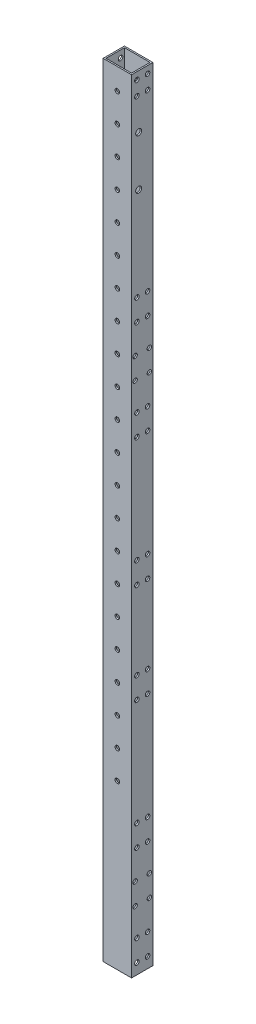
from build123d import *

# Parameters (mm, degrees)
SKETCH_1_W          = 20
SKETCH_1_H          = 15
SKETCH_1_W_2        = 18
SKETCH_1_H_2        = 13
EXTRUDE_1_DEPTH     = 550
SKETCH_4_R          = 1.6
CUT_EXTRUDE_1_DEPTH = 551.414616448
SKETCH_5_R          = 2.1
CUT_EXTRUDE_2_DEPTH = 551.414616448
SKETCH_6_R          = 1.6
CUT_EXTRUDE_3_DEPTH = 551.414616448
SKETCH_7_R          = 1.6
CUT_EXTRUDE_4_DEPTH = 551.29537523
SKETCH_8_R          = 1.55
CUT_EXTRUDE_5_DEPTH = 551.414616448


with BuildPart() as part:
    # 草图1 → 拉伸-薄壁1 (new body)
    with BuildSketch(Plane(origin=(0, 0, 0), x_dir=(1, 0, 0), z_dir=(0, 1, 0))):
        Rectangle(SKETCH_1_W, SKETCH_1_H)
        Rectangle(SKETCH_1_W_2, SKETCH_1_H_2, mode=Mode.SUBTRACT)
    extrude(amount=EXTRUDE_1_DEPTH)

    # 草图4 → 切除-拉伸1 (cut, through all)
    with BuildSketch(Plane.ZY.offset(10)):
        with Locations((-3.75, 545)):
            Circle(SKETCH_4_R)
        with Locations(Location((-3.75, 535, 0), (0, 0, 180))):
            Circle(SKETCH_4_R)
        with Locations((3.75, 535)):
            Circle(SKETCH_4_R)
        with Locations(Location((3.75, 545, 0), (0, 0, 180))):
            Circle(SKETCH_4_R)
    extrude(amount=-CUT_EXTRUDE_1_DEPTH, mode=Mode.SUBTRACT)

    # 草图5 → 切除-拉伸2 (cut, through all)
    with BuildSketch(Plane.ZY.offset(10)):
        with Locations((2.5, 512.5)):
            Circle(SKETCH_5_R)
        with Locations((2.5, 477.5)):
            Circle(SKETCH_5_R)
    extrude(amount=-CUT_EXTRUDE_2_DEPTH, mode=Mode.SUBTRACT)

    # 草图6 → 切除-拉伸3 (cut, through all)
    with BuildSketch(Plane(origin=(10, 0, 0), x_dir=(0, 0, -1), z_dir=(1, 0, 0))):
        with Locations((-3.75, 7.5)):
            Circle(SKETCH_6_R)
        with Locations((-3.75, 22.5)):
            Circle(SKETCH_6_R)
        with Locations((3.75, 7.5)):
            Circle(SKETCH_6_R)
        with Locations((3.75, 22.5)):
            Circle(SKETCH_6_R)
        with Locations((-3.75, 92.5)):
            Circle(SKETCH_6_R)
        with Locations((3.75, 92.5)):
            Circle(SKETCH_6_R)
        with Locations((3.75, 77.5)):
            Circle(SKETCH_6_R)
        with Locations((-3.75, 77.5)):
            Circle(SKETCH_6_R)
        with Locations((-3.75, 167.5)):
            Circle(SKETCH_6_R)
        with Locations((-3.75, 182.5)):
            Circle(SKETCH_6_R)
        with Locations((3.75, 167.5)):
            Circle(SKETCH_6_R)
        with Locations((3.75, 182.5)):
            Circle(SKETCH_6_R)
        with Locations((-3.75, 252.5)):
            Circle(SKETCH_6_R)
        with Locations((3.75, 252.5)):
            Circle(SKETCH_6_R)
        with Locations((3.75, 237.5)):
            Circle(SKETCH_6_R)
        with Locations((-3.75, 237.5)):
            Circle(SKETCH_6_R)
        with Locations((-3.75, 327.5)):
            Circle(SKETCH_6_R)
        with Locations((-3.75, 342.5)):
            Circle(SKETCH_6_R)
        with Locations((3.75, 327.5)):
            Circle(SKETCH_6_R)
        with Locations((3.75, 342.5)):
            Circle(SKETCH_6_R)
        with Locations((-3.75, 412.5)):
            Circle(SKETCH_6_R)
        with Locations((3.75, 412.5)):
            Circle(SKETCH_6_R)
        with Locations((3.75, 397.5)):
            Circle(SKETCH_6_R)
        with Locations((-3.75, 397.5)):
            Circle(SKETCH_6_R)
    extrude(amount=-CUT_EXTRUDE_3_DEPTH, mode=Mode.SUBTRACT)

    # 草图7 → 切除-拉伸4 (cut, through all)
    with BuildSketch(Plane(origin=(0, 0, -7.5), x_dir=(-1, 0, 0), z_dir=(0, 0, -1))):
        with Locations((0, 115)):
            Circle(SKETCH_7_R)
        with Locations((0, 135)):
            Circle(SKETCH_7_R)
        with Locations((0, 155)):
            Circle(SKETCH_7_R)
        with Locations((0, 175)):
            Circle(SKETCH_7_R)
        with Locations((0, 195)):
            Circle(SKETCH_7_R)
        with Locations((0, 215)):
            Circle(SKETCH_7_R)
        with Locations((0, 235)):
            Circle(SKETCH_7_R)
        with Locations((0, 255)):
            Circle(SKETCH_7_R)
        with Locations((0, 275)):
            Circle(SKETCH_7_R)
        with Locations((0, 295)):
            Circle(SKETCH_7_R)
        with Locations((0, 315)):
            Circle(SKETCH_7_R)
        with Locations((0, 335)):
            Circle(SKETCH_7_R)
        with Locations((0, 355)):
            Circle(SKETCH_7_R)
        with Locations((0, 375)):
            Circle(SKETCH_7_R)
        with Locations((0, 395)):
            Circle(SKETCH_7_R)
        with Locations((0, 415)):
            Circle(SKETCH_7_R)
        with Locations((0, 435)):
            Circle(SKETCH_7_R)
        with Locations((0, 455)):
            Circle(SKETCH_7_R)
        with Locations((0, 475)):
            Circle(SKETCH_7_R)
        with Locations((0, 495)):
            Circle(SKETCH_7_R)
        with Locations((0, 515)):
            Circle(SKETCH_7_R)
        with Locations((0, 535)):
            Circle(SKETCH_7_R)
    extrude(amount=-CUT_EXTRUDE_4_DEPTH, mode=Mode.SUBTRACT)

    # 草图8 → 切除-拉伸5 (cut, through all)
    with BuildSketch(Plane(origin=(10, 0, 0), x_dir=(0, 0, -1), z_dir=(1, 0, 0))):
        with Locations((5, 377.5)):
            Circle(SKETCH_8_R)
        with Locations(Location((-5, 377.5, 0), (0, 0, 180))):
            Circle(SKETCH_8_R)
        with Locations(Location((5, 362.5, 0), (0, 0, 180))):
            Circle(SKETCH_8_R)
        with Locations((-5, 362.5)):
            Circle(SKETCH_8_R)
        with Locations((5, 57.5)):
            Circle(SKETCH_8_R)
        with Locations(Location((-5, 57.5, 0), (0, 0, 180))):
            Circle(SKETCH_8_R)
        with Locations(Location((5, 42.5, 0), (0, 0, 180))):
            Circle(SKETCH_8_R)
        with Locations((-5, 42.5)):
            Circle(SKETCH_8_R)
    extrude(amount=-CUT_EXTRUDE_5_DEPTH, mode=Mode.SUBTRACT)


solid = part.part
